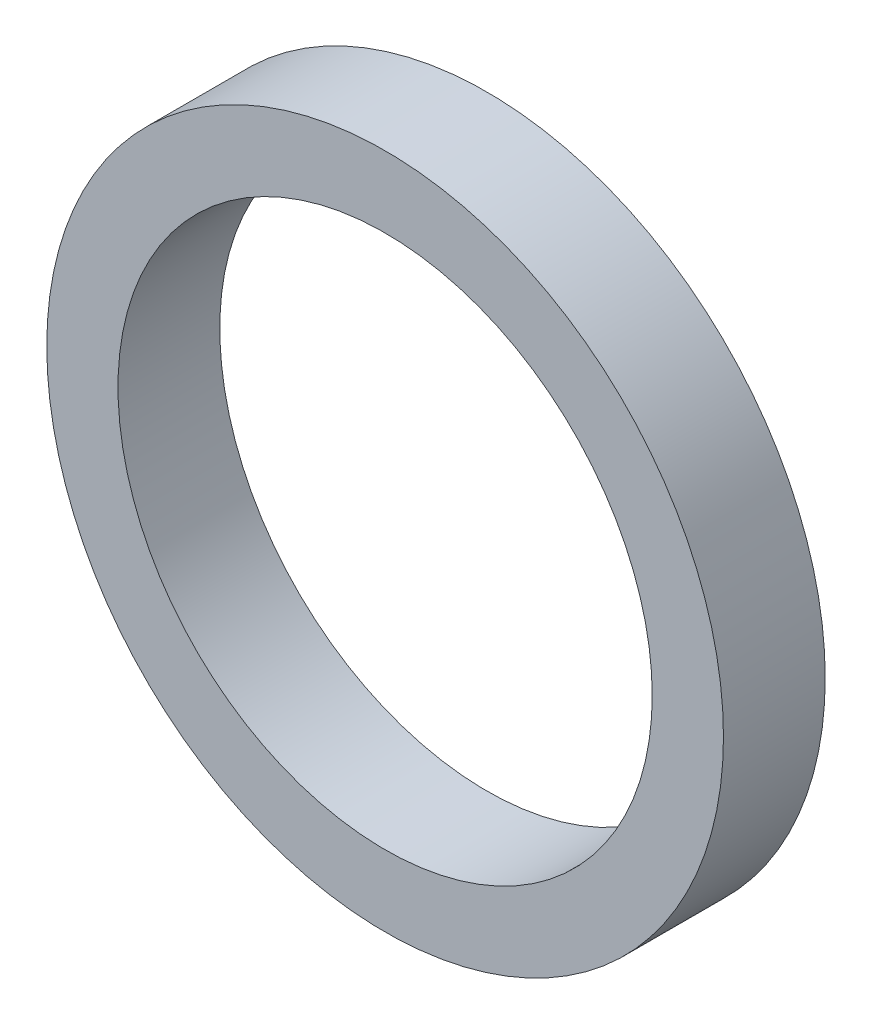
from build123d import *

# Parameters (mm, degrees)
SKETCH1_R           = 3.325
SKETCH1_R_2         = 2.625
BOSS_EXTRUDE1_DEPTH = 1


with BuildPart() as part:
    # Sketch1 → Boss-Extrude1 (new body)
    with BuildSketch(Plane.XY.offset(3)):
        with Locations((33, 0)):
            Circle(SKETCH1_R)
        with Locations((33, 0)):
            Circle(SKETCH1_R_2, mode=Mode.SUBTRACT)
    extrude(amount=BOSS_EXTRUDE1_DEPTH)


solid = part.part
